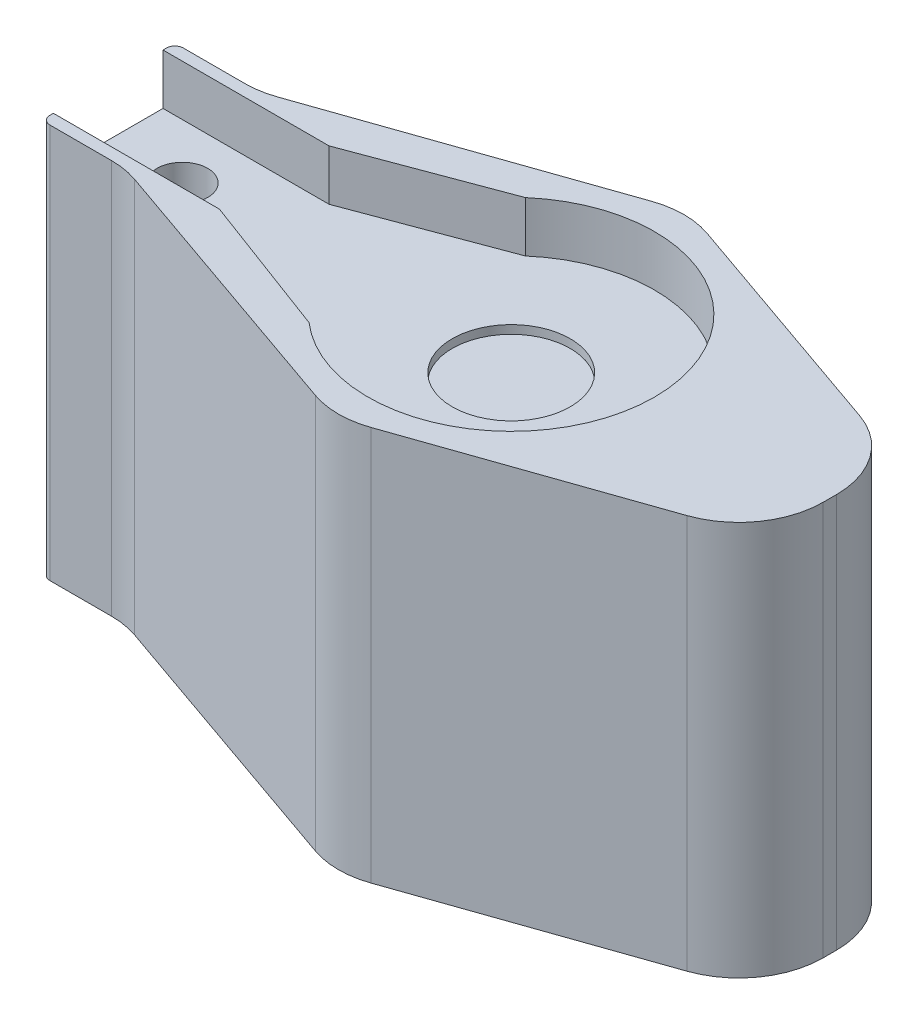
from build123d import *

# Parameters (mm, degrees)
BOSS_EXTRUDE1_DEPTH = 15
FILLET2_R           = 2
FILLET3_R           = 2
FILLET4_R           = 2
FILLET5_R           = 2
FILLET6_R           = 2
FILLET7_R           = 2
BOSS_EXTRUDE2_DEPTH = 8.4
SKETCH4_W           = 7.910383638
SKETCH4_H           = 23.4
BOSS_EXTRUDE3_DEPTH = 5
CUT_EXTRUDE1_DEPTH  = 6
CUT_EXTRUDE2_DEPTH  = 3
SKETCH5_R           = 3.5
CUT_EXTRUDE3_DEPTH  = 0.5
FILLET8_R           = 0.5
FILLET9_R           = 0.5
FILLET10_R          = 5
FILLET11_R          = 5
FILLET12_R          = 5
FILLET13_R          = 5
FILLET14_R          = 5
FILLET15_R          = 5


with BuildPart() as part:
    # Sketch1 → Boss-Extrude1 (new body)
    with BuildSketch(Plane(origin=(0, 0, 0), x_dir=(1, 0, 0), z_dir=(0, 1, 0))):
        Polygon((-2.4, -1.705191819), (16.5, -8.291555455), (35.4, -1.705191819), (35.4, 6.205191819), (16.5, 12.791555455), (-2.4, 6.205191819), align=None)
        Polygon((0, 0), (16.5, -5.75), (33, 0), (33, 4.5), (16.5, 10.25), (0, 4.5), align=None, mode=Mode.SUBTRACT)
    extrude(amount=-BOSS_EXTRUDE1_DEPTH)

    # Fillet2
    fillet2_edges = [part.edges().sort_by_distance(p)[0] for p in [
        (0, -7.5, -4.5),
    ]]
    fillet(fillet2_edges, radius=FILLET2_R)

    # Fillet3
    fillet3_edges = [part.edges().sort_by_distance(p)[0] for p in [
        (16.5, -7.5, -10.25),
    ]]
    fillet(fillet3_edges, radius=FILLET3_R)

    # Fillet4
    fillet4_edges = [part.edges().sort_by_distance(p)[0] for p in [
        (33, -7.5, -4.5),
    ]]
    fillet(fillet4_edges, radius=FILLET4_R)

    # Fillet5
    fillet5_edges = [part.edges().sort_by_distance(p)[0] for p in [
        (0, -7.5, 0),
    ]]
    fillet(fillet5_edges, radius=FILLET5_R)

    # Fillet6
    fillet6_edges = [part.edges().sort_by_distance(p)[0] for p in [
        (16.5, -7.5, 5.75),
    ]]
    fillet(fillet6_edges, radius=FILLET6_R)

    # Fillet7
    fillet7_edges = [part.edges().sort_by_distance(p)[0] for p in [
        (33, -7.5, 0),
    ]]
    fillet(fillet7_edges, radius=FILLET7_R)

    # Sketch2 → Boss-Extrude2 (add)
    with BuildSketch(Plane(origin=(0, 0, 0), x_dir=(1, 0, 0), z_dir=(0, 1, 0))):
        Polygon((16.5, -8.291555455), (-2.4, -1.705191819), (-2.4, 6.205191819), (16.5, 12.791555455), (35.4, 6.205191819), (35.4, -1.705191819), align=None)
    extrude(amount=BOSS_EXTRUDE2_DEPTH)

    # Sketch4 → Boss-Extrude3 (add)
    with BuildSketch(Plane.ZY.offset(2.4)):
        with Locations((-2.25, -3.3)):
            Rectangle(SKETCH4_W, SKETCH4_H)
    extrude(amount=BOSS_EXTRUDE3_DEPTH)

    # Sketch3 → Cut-Extrude1 (cut)
    with BuildSketch(Plane(origin=(0, 8.4, 0), x_dir=(1, 0, 0), z_dir=(0, 1, 0))):
        with BuildLine():
            Line((-2.4, 2.25), (-2.4, 0.875227292))
            ThreePointArc((-2.4, 0.875227292), (-1.74500996, 1.428416164), (-1.5, 2.25))
            Line((-1.5, 2.25), (-2.4, 2.25))
        make_face()
        with BuildLine():
            ThreePointArc((-4.5, 2.25), (-3.821583836, 0.99500996), (-2.4, 0.875227292))
            Line((-2.4, 0.875227292), (-2.4, 2.25))
            Line((-2.4, 2.25), (-4.5, 2.25))
        make_face()
        with BuildLine():
            Line((-2.4, 2.25), (-1.5, 2.25))
            ThreePointArc((-1.5, 2.25), (-1.74500996, 3.071583836), (-2.4, 3.624772708))
            Line((-2.4, 3.624772708), (-2.4, 2.25))
        make_face()
        with BuildLine():
            ThreePointArc((-2.4, 3.624772708), (-3.821583836, 3.50499004), (-4.5, 2.25))
            Line((-4.5, 2.25), (-2.4, 2.25))
            Line((-2.4, 2.25), (-2.4, 3.624772708))
        make_face()
        with BuildLine():
            Line((-2.4, 2.25), (-2.4, 0.875227292))
            ThreePointArc((-2.4, 0.875227292), (-1.74500996, 1.428416164), (-1.5, 2.25))
            Line((-1.5, 2.25), (-2.4, 2.25))
        make_face()
        with BuildLine():
            ThreePointArc((-4.5, 2.25), (-3.821583836, 0.99500996), (-2.4, 0.875227292))
            Line((-2.4, 0.875227292), (-2.4, 2.25))
            Line((-2.4, 2.25), (-4.5, 2.25))
        make_face()
        with BuildLine():
            Line((-2.4, 2.25), (-1.5, 2.25))
            ThreePointArc((-1.5, 2.25), (-1.74500996, 3.071583836), (-2.4, 3.624772708))
            Line((-2.4, 3.624772708), (-2.4, 2.25))
        make_face()
        with BuildLine():
            ThreePointArc((-2.4, 3.624772708), (-3.821583836, 3.50499004), (-4.5, 2.25))
            Line((-4.5, 2.25), (-2.4, 2.25))
            Line((-2.4, 2.25), (-2.4, 3.624772708))
        make_face()
        with BuildLine():
            Line((-2.4, 2.25), (-2.4, 0.875227292))
            ThreePointArc((-2.4, 0.875227292), (-1.74500996, 1.428416164), (-1.5, 2.25))
            Line((-1.5, 2.25), (-2.4, 2.25))
        make_face()
        with BuildLine():
            ThreePointArc((-4.5, 2.25), (-3.821583836, 0.99500996), (-2.4, 0.875227292))
            Line((-2.4, 0.875227292), (-2.4, 2.25))
            Line((-2.4, 2.25), (-4.5, 2.25))
        make_face()
        with BuildLine():
            Line((-2.4, 2.25), (-1.5, 2.25))
            ThreePointArc((-1.5, 2.25), (-1.74500996, 3.071583836), (-2.4, 3.624772708))
            Line((-2.4, 3.624772708), (-2.4, 2.25))
        make_face()
        with BuildLine():
            ThreePointArc((-2.4, 3.624772708), (-3.821583836, 3.50499004), (-4.5, 2.25))
            Line((-4.5, 2.25), (-2.4, 2.25))
            Line((-2.4, 2.25), (-2.4, 3.624772708))
        make_face()
        with BuildLine():
            Line((-2.4, 2.25), (-2.4, 0.875227292))
            ThreePointArc((-2.4, 0.875227292), (-1.74500996, 1.428416164), (-1.5, 2.25))
            Line((-1.5, 2.25), (-2.4, 2.25))
        make_face()
        with BuildLine():
            ThreePointArc((-4.5, 2.25), (-3.821583836, 0.99500996), (-2.4, 0.875227292))
            Line((-2.4, 0.875227292), (-2.4, 2.25))
            Line((-2.4, 2.25), (-4.5, 2.25))
        make_face()
        with BuildLine():
            Line((-2.4, 2.25), (-1.5, 2.25))
            ThreePointArc((-1.5, 2.25), (-1.74500996, 3.071583836), (-2.4, 3.624772708))
            Line((-2.4, 3.624772708), (-2.4, 2.25))
        make_face()
        with BuildLine():
            ThreePointArc((-2.4, 3.624772708), (-3.821583836, 3.50499004), (-4.5, 2.25))
            Line((-4.5, 2.25), (-2.4, 2.25))
            Line((-2.4, 2.25), (-2.4, 3.624772708))
        make_face()
    extrude(amount=-CUT_EXTRUDE1_DEPTH, mode=Mode.SUBTRACT)

    # Sketch3<3> → Cut-Extrude2 (cut)
    with BuildSketch(Plane(origin=(0, 8.4, 0), x_dir=(1, 0, 0), z_dir=(0, 1, 0))):
        with BuildLine():
            Line((16.5, -1), (16.5, -6.25))
            ThreePointArc((16.5, -6.25), (21.223610907, -4.816647013), (24.354139036, -1))
            Line((24.354139036, -1), (16.5, -1))
        make_face()
        with BuildLine():
            Line((10.926339286, -4.1675), (16.5, -6.25))
            Line((16.5, -6.25), (16.5, -1))
            Line((16.5, -1), (8.645860964, -1))
            ThreePointArc((8.645860964, -1), (9.601832447, -2.71641565), (10.926339286, -4.1675))
        make_face()
        with BuildLine():
            ThreePointArc((10.926339286, -4.1675), (13.525, -5.712372448), (16.5, -6.25))
            Line((16.5, -6.25), (10.926339286, -4.1675))
        make_face()
        with BuildLine():
            Line((16.5, 2.25), (16.5, -1))
            Line((16.5, -1), (24.354139036, -1))
            ThreePointArc((24.354139036, -1), (24.836971327, 0.593223281), (25, 2.25))
            Line((25, 2.25), (16.5, 2.25))
        make_face()
        with BuildLine():
            Line((8.645860964, -1), (16.5, -1))
            Line((16.5, -1), (16.5, 2.25))
            Line((16.5, 2.25), (8, 2.25))
            ThreePointArc((8, 2.25), (8.163028673, 0.593223281), (8.645860964, -1))
        make_face()
        with BuildLine():
            Line((16.5, 5.5), (16.5, 2.25))
            Line((16.5, 2.25), (25, 2.25))
            ThreePointArc((25, 2.25), (24.836971327, 3.906776719), (24.354139036, 5.5))
            Line((24.354139036, 5.5), (16.5, 5.5))
        make_face()
        with BuildLine():
            Line((8, 2.25), (16.5, 2.25))
            Line((16.5, 2.25), (16.5, 5.5))
            Line((16.5, 5.5), (8.645860964, 5.5))
            ThreePointArc((8.645860964, 5.5), (8.163028673, 3.906776719), (8, 2.25))
        make_face()
        with BuildLine():
            Line((16.5, 10.75), (16.5, 5.5))
            Line((16.5, 5.5), (24.354139036, 5.5))
            ThreePointArc((24.354139036, 5.5), (21.223610907, 9.316647013), (16.5, 10.75))
        make_face()
        with BuildLine():
            Line((8.645860964, 5.5), (16.5, 5.5))
            Line((16.5, 5.5), (16.5, 10.75))
            Line((16.5, 10.75), (10.926339286, 8.6675))
            ThreePointArc((10.926339286, 8.6675), (9.601832447, 7.21641565), (8.645860964, 5.5))
        make_face()
        with BuildLine():
            Line((10.926339286, 8.6675), (16.5, 10.75))
            ThreePointArc((16.5, 10.75), (13.525, 10.212372448), (10.926339286, 8.6675))
        make_face()
        with BuildLine():
            Line((16.5, 5.5), (16.5, 2.25))
            Line((16.5, 2.25), (25, 2.25))
            ThreePointArc((25, 2.25), (24.836971327, 3.906776719), (24.354139036, 5.5))
            Line((24.354139036, 5.5), (16.5, 5.5))
        make_face()
        with BuildLine():
            Line((8, 2.25), (16.5, 2.25))
            Line((16.5, 2.25), (16.5, 5.5))
            Line((16.5, 5.5), (8.645860964, 5.5))
            ThreePointArc((8.645860964, 5.5), (8.163028673, 3.906776719), (8, 2.25))
        make_face()
        with BuildLine():
            Line((16.5, 2.25), (16.5, -1))
            Line((16.5, -1), (24.354139036, -1))
            ThreePointArc((24.354139036, -1), (24.836971327, 0.593223281), (25, 2.25))
            Line((25, 2.25), (16.5, 2.25))
        make_face()
        with BuildLine():
            Line((8.645860964, -1), (16.5, -1))
            Line((16.5, -1), (16.5, 2.25))
            Line((16.5, 2.25), (8, 2.25))
            ThreePointArc((8, 2.25), (8.163028673, 0.593223281), (8.645860964, -1))
        make_face()
        with BuildLine():
            Line((2.448754504, -1), (10.926339286, -4.1675))
            ThreePointArc((10.926339286, -4.1675), (9.601832447, -2.71641565), (8.645860964, -1))
            Line((8.645860964, -1), (2.448754504, -1))
        make_face()
        with BuildLine():
            Line((2.448754504, 2.25), (2.448754504, -1))
            Line((2.448754504, -1), (8.645860964, -1))
            ThreePointArc((8.645860964, -1), (8.163028673, 0.593223281), (8, 2.25))
            Line((8, 2.25), (2.448754504, 2.25))
        make_face()
        with BuildLine():
            Line((2.448754504, 5.5), (2.448754504, 2.25))
            Line((2.448754504, 2.25), (8, 2.25))
            ThreePointArc((8, 2.25), (8.163028673, 3.906776719), (8.645860964, 5.5))
            Line((8.645860964, 5.5), (2.448754504, 5.5))
        make_face()
        with BuildLine():
            Line((10.926339286, 8.6675), (2.448754504, 5.5))
            Line((2.448754504, 5.5), (8.645860964, 5.5))
            ThreePointArc((8.645860964, 5.5), (9.601832447, 7.21641565), (10.926339286, 8.6675))
        make_face()
        with BuildLine():
            Line((-2.4, -1), (2.448754504, -1))
            Line((2.448754504, -1), (2.448754504, 2.25))
            Line((2.448754504, 2.25), (-1.5, 2.25))
            ThreePointArc((-1.5, 2.25), (-1.74500996, 1.428416164), (-2.4, 0.875227292))
            Line((-2.4, 0.875227292), (-2.4, -1))
        make_face()
        with BuildLine():
            Line((-1.5, 2.25), (2.448754504, 2.25))
            Line((2.448754504, 2.25), (2.448754504, 5.5))
            Line((2.448754504, 5.5), (-2.4, 5.5))
            Line((-2.4, 5.5), (-2.4, 3.624772708))
            ThreePointArc((-2.4, 3.624772708), (-1.74500996, 3.071583836), (-1.5, 2.25))
        make_face()
        with BuildLine():
            Line((-10, 5.5), (-10, 2.25))
            Line((-10, 2.25), (-4.5, 2.25))
            ThreePointArc((-4.5, 2.25), (-3.821583836, 3.50499004), (-2.4, 3.624772708))
            Line((-2.4, 3.624772708), (-2.4, 5.5))
            Line((-2.4, 5.5), (-10, 5.5))
        make_face()
        with BuildLine():
            Line((-10, -1), (-2.4, -1))
            Line((-2.4, -1), (-2.4, 0.875227292))
            ThreePointArc((-2.4, 0.875227292), (-3.821583836, 0.99500996), (-4.5, 2.25))
            Line((-4.5, 2.25), (-10, 2.25))
            Line((-10, 2.25), (-10, -1))
        make_face()
    extrude(amount=-CUT_EXTRUDE2_DEPTH, mode=Mode.SUBTRACT)

    # Sketch5 → Cut-Extrude3 (cut)
    with BuildSketch(Plane(origin=(0, 5.4, 0), x_dir=(1, 0, 0), z_dir=(0, 1, 0))):
        with Locations(Location((16.5, 2.25, 0), (0, 0, 270))):
            Circle(SKETCH5_R)
    extrude(amount=-CUT_EXTRUDE3_DEPTH, mode=Mode.SUBTRACT)

    # Fillet8
    fillet8_edges = [part.edges().sort_by_distance(p)[0] for p in [
        (-7.4, -3.3, -6.205191819),
    ]]
    fillet(fillet8_edges, radius=FILLET8_R)

    # Fillet9
    fillet9_edges = [part.edges().sort_by_distance(p)[0] for p in [
        (-7.4, -3.3, 1.705191819),
    ]]
    fillet(fillet9_edges, radius=FILLET9_R)

    # Fillet10
    fillet10_edges = [part.edges().sort_by_distance(p)[0] for p in [
        (-2.4, -3.3, -6.205191819),
    ]]
    fillet(fillet10_edges, radius=FILLET10_R)

    # Fillet11
    fillet11_edges = [part.edges().sort_by_distance(p)[0] for p in [
        (-2.4, -3.3, 1.705191819),
    ]]
    fillet(fillet11_edges, radius=FILLET11_R)

    # Fillet12
    fillet12_edges = [part.edges().sort_by_distance(p)[0] for p in [
        (16.5, -3.3, 8.291555455),
    ]]
    fillet(fillet12_edges, radius=FILLET12_R)

    # Fillet13
    fillet13_edges = [part.edges().sort_by_distance(p)[0] for p in [
        (16.5, -3.3, -12.791555455),
    ]]
    fillet(fillet13_edges, radius=FILLET13_R)

    # Fillet14
    fillet14_edges = [part.edges().sort_by_distance(p)[0] for p in [
        (35.4, -3.3, -6.205191819),
    ]]
    fillet(fillet14_edges, radius=FILLET14_R)

    # Fillet15
    fillet15_edges = [part.edges().sort_by_distance(p)[0] for p in [
        (35.4, -3.3, 1.705191819),
    ]]
    fillet(fillet15_edges, radius=FILLET15_R)


solid = part.part
